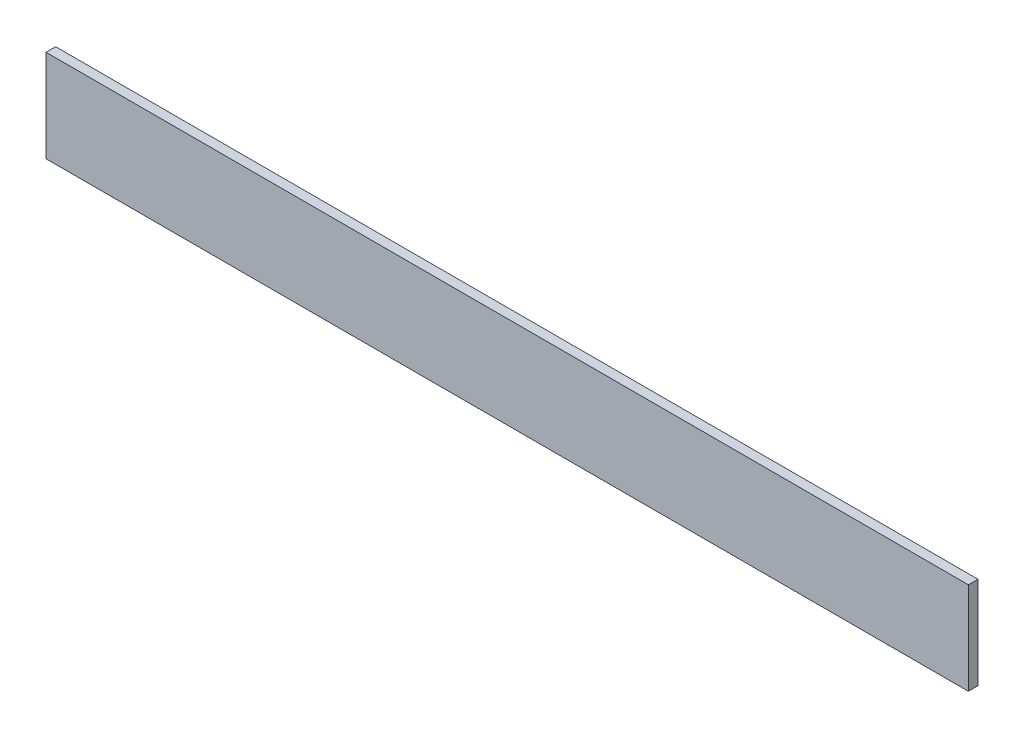
from build123d import *

# Parameters (mm, degrees)
SKETCH_1_W      = 10000
SKETCH_1_H      = 104.446930851
EXTRUDE_1_DEPTH = 1000


with BuildPart() as part:
    # 草图1 → 凸台-拉伸1 (new body)
    with BuildSketch(Plane(origin=(0, 0, 0), x_dir=(1, 0, 0), z_dir=(0, 1, 0))):
        with Locations((5000, -52.223465426)):
            Rectangle(SKETCH_1_W, SKETCH_1_H)
    extrude(amount=EXTRUDE_1_DEPTH)


solid = part.part
